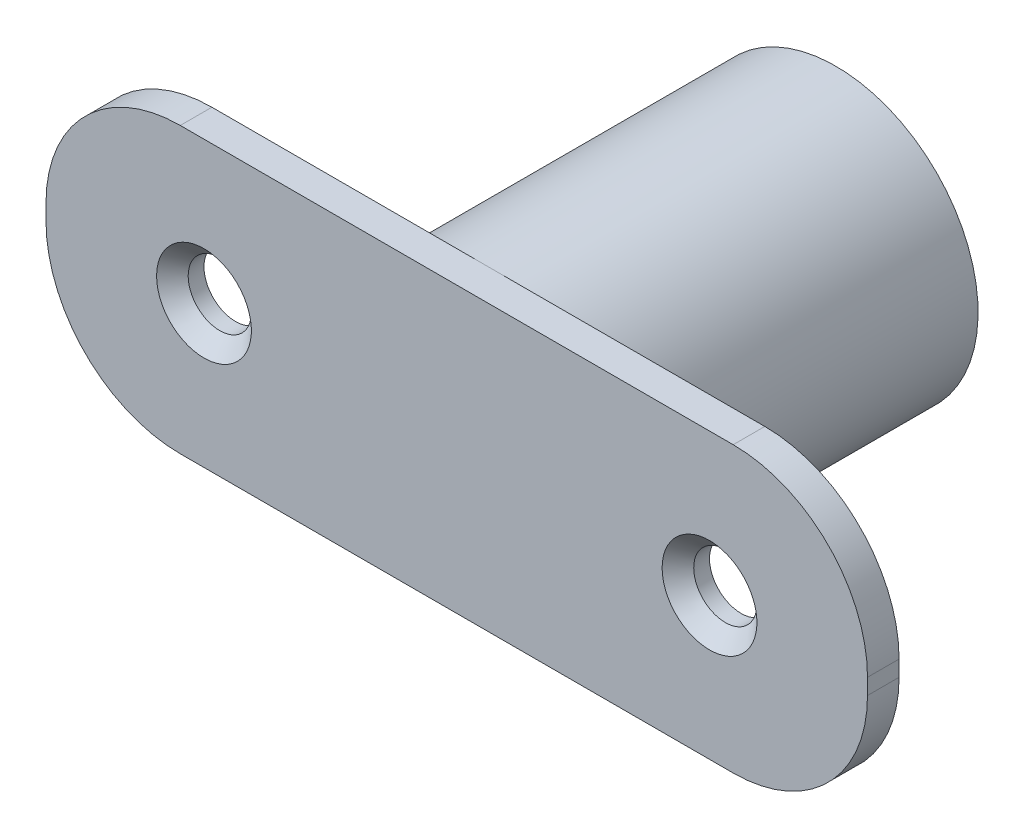
from build123d import *

# Parameters (mm, degrees)
ESQUISSE1_R        = 2
BOSS_EXTRU_1_DEPTH = 2
BOSS_EXTRU_2_DEPTH = 22
CHANFREIN1_SIZE    = 1


with BuildPart() as part:
    # Esquisse1 → Boss.-Extru.1 (new body)
    with BuildSketch(Plane.XY):
        with BuildLine():
            Line((8.5, 0), (43.5, 0))
            ThreePointArc((43.5, 0), (49.51040764, -2.48959236), (52, -8.5))
            Line((52, -8.5), (52, -9.5))
            ThreePointArc((52, -9.5), (49.51040764, -15.51040764), (43.5, -18))
            Line((43.5, -18), (8.5, -18))
            ThreePointArc((8.5, -18), (2.48959236, -15.51040764), (0, -9.5))
            Line((0, -9.5), (0, -8.5))
            ThreePointArc((0, -8.5), (2.48959236, -2.48959236), (8.5, 0))
        make_face()
        with Locations((10, -9)):
            Circle(ESQUISSE1_R, mode=Mode.SUBTRACT)
        with Locations((42, -9)):
            Circle(ESQUISSE1_R, mode=Mode.SUBTRACT)
    extrude(amount=BOSS_EXTRU_1_DEPTH)

    # Esquisse2 → Boss.-Extru.2 (add)
    with BuildSketch(Plane(origin=(0, 0, 0), x_dir=(-1, 0, 0), z_dir=(0, 0, -1))):
        with BuildLine():
            ThreePointArc((-35, -9), (-32.363961031, -15.363961031), (-26, -18))
            Line((-26, -18), (-26, -9))
            Line((-26, -9), (-35, -9))
        make_face()
        with BuildLine():
            Line((-26, -9), (-26, -18))
            ThreePointArc((-26, -18), (-19.636038969, -15.363961031), (-17, -9))
            Line((-17, -9), (-26, -9))
        make_face()
        with BuildLine():
            Line((-35, -9), (-26, -9))
            Line((-26, -9), (-26, 0))
            ThreePointArc((-26, 0), (-32.363961031, -2.636038969), (-35, -9))
        make_face()
        with BuildLine():
            Line((-26, 0), (-26, -9))
            Line((-26, -9), (-17, -9))
            ThreePointArc((-17, -9), (-19.636038969, -2.636038969), (-26, 0))
        make_face()
    extrude(amount=BOSS_EXTRU_2_DEPTH)

    # Chanfrein1
    chanfrein1_edges = [part.edges().sort_by_distance(p)[0] for p in [
        (8, -9, 2),
        (40, -9, 2),
    ]]
    chamfer(chanfrein1_edges, length=CHANFREIN1_SIZE)


solid = part.part
